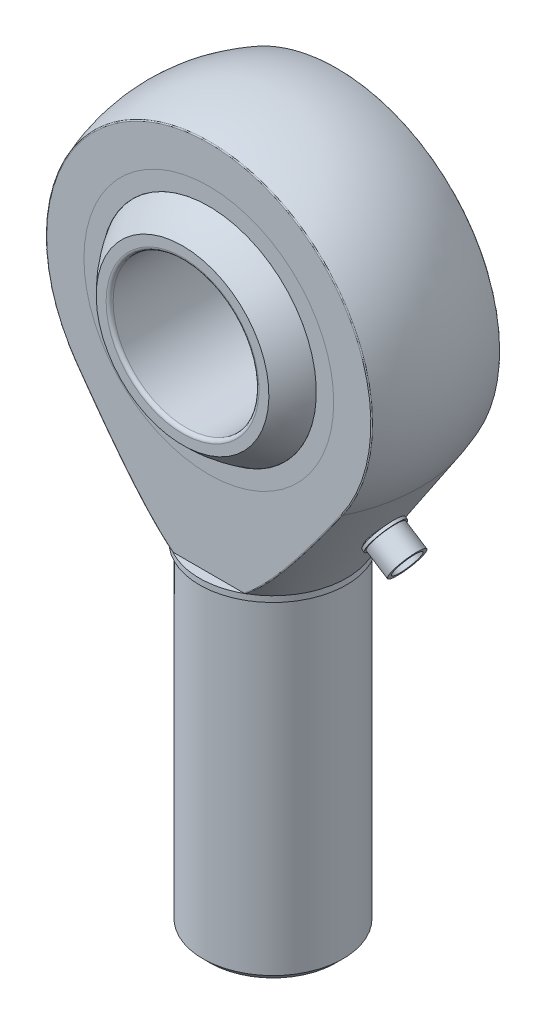
from build123d import *

# Parameters (mm, degrees)
CUT_EXTRUDE_1_DEPTH      = 132.057239403
CUT_EXTRUDE_1_DEPTH_BACK = 132.057239403
SKETCH_4_W               = 19
SKETCH_4_H               = 66
FILLET_1_R               = 0.02
FILLET_2_R               = 0.02
FILLET_3_R               = 0.2
FILLET_4_R               = 0.6


with BuildPart() as part:
    # 草图3 → 旋转2 (revolve)
    with BuildSketch(Plane.XY):
        with BuildLine():
            Line((-12, 57), (-12.6, 57))
            Line((-12.6, 57), (-12.6, 58))
            Line((-12.6, 58), (-25.280878776, 77.848307572))
            ThreePointArc((-25.280878776, 77.848307572), (-26.311126666, 108.412654633), (0, 124))
            Line((0, 124), (0, 0))
            Line((0, 0), (-10.8, 0))
            Line((-10.8, 0), (-12, 1.2))
            Line((-12, 1.2), (-12, 57))
        make_face()
    revolve(axis=Axis((0, 124, 0), (0, -1, 0)))

    # 草图4 → 切除-拉伸1 (cut, two sides: drawn at the far end of the back side and taken through both)
    with BuildSketch(Plane(origin=(0, 0, 0), x_dir=(0, 0, -1), z_dir=(1, 0, 0)).offset(-CUT_EXTRUDE_1_DEPTH_BACK)):
        with Locations((-20.5, 91)):
            Rectangle(SKETCH_4_W, SKETCH_4_H)
        with Locations((20.5, 91)):
            Rectangle(SKETCH_4_W, SKETCH_4_H)
    extrude(amount=CUT_EXTRUDE_1_DEPTH + CUT_EXTRUDE_1_DEPTH_BACK, mode=Mode.SUBTRACT)

    # 草图5 → 切除-旋转1 (revolve, cut)
    with BuildSketch(Plane(origin=(0, 0, 0), x_dir=(0, 0, -1), z_dir=(1, 0, 0))):
        with BuildLine():
            ThreePointArc((-11, 112.391435507), (-13.371231769, 110.746792558), (-15.5, 108.798476273))
            Line((-15.5, 108.798476273), (-15.5, 94))
            Line((-15.5, 94), (15.5, 94))
            Line((15.5, 94), (15.5, 108.798476273))
            ThreePointArc((15.5, 108.798476273), (13.371231769, 110.746792558), (11, 112.391435507))
            Line((11, 112.391435507), (11, 115.401294946))
            Line((11, 115.401294946), (1.11436, 117.1444))
            Line((1.11436, 117.1444), (1.11436, 115.401007027))
            ThreePointArc((1.11436, 115.401007027), (0, 115.43), (-1.11436, 115.401007027))
            Line((-1.11436, 115.401007027), (-1.11436, 117.1444))
            Line((-1.11436, 117.1444), (-11, 115.401294946))
            Line((-11, 115.401294946), (-11, 112.391435507))
        make_face()
    revolve(axis=Axis((0, 94, 25.009899453), (0, 0, -1)), mode=Mode.SUBTRACT)

    # 圆角3
    fillet_3_edges = [part.edges().sort_by_distance(p)[0] for p in [
        (-15.026137063, 67.425975947, -11),
        (15.026137063, 67.425975947, -11),
        (15.026137063, 67.425975947, 11),
        (-15.026137063, 67.425975947, 11),
        (0, 121.910571474, -11),
        (0, 121.910571474, 11),
    ]]
    fillet(fillet_3_edges, radius=FILLET_3_R)

    # 草图6 → 旋转5 (revolve)
    with BuildSketch(Plane.XY):
        Polygon((20.564035591, 70.446857766), (19.721339631, 70.985247514), (19.398305783, 70.479629938), (24.285942346, 67.356969402), (24.608976195, 67.862586977), (20.968529651, 70.188430687), (21.130046575, 70.441239475), (20.725552515, 70.699666554), align=None)
    revolve(axis=Axis((18.940439388, 67.924153786, 0), (0.8426959592098153, -0.5383897476098978, 0)))


with BuildPart() as body_2:
    # 草图5<4> → 旋转3 (revolve)
    with BuildSketch(Plane(origin=(0, 0, 0), x_dir=(0, 0, -1), z_dir=(1, 0, 0))):
        with BuildLine():
            Line((-11, 115.401294946), (-11, 112.391435507))
            ThreePointArc((-11, 112.391435507), (-6.241298722, 114.501002177), (-1.11436, 115.401007027))
            Line((-1.11436, 115.401007027), (-1.11436, 117.1444))
            Line((-1.11436, 117.1444), (-11, 115.401294946))
        make_face()
        with BuildLine():
            Line((1.11436, 117.1444), (1.11436, 115.401007027))
            ThreePointArc((1.11436, 115.401007027), (6.241298722, 114.501002177), (11, 112.391435507))
            Line((11, 112.391435507), (11, 115.401294946))
            Line((11, 115.401294946), (1.11436, 117.1444))
        make_face()
    revolve(axis=Axis((0, 94, 25.009899453), (0, 0, -1)))

    # 圆角1
    fillet_1_edges = [body_2.edges().sort_by_distance(p)[0] for p in [
        (0, 75.608564493, 11),
    ]]
    fillet(fillet_1_edges, radius=FILLET_1_R)

    # 圆角2
    fillet_2_edges = [body_2.edges().sort_by_distance(p)[0] for p in [
        (0, 72.598705054, -11),
        (0, 75.608564493, -11),
    ]]
    fillet(fillet_2_edges, radius=FILLET_2_R)


with BuildPart() as body_3:
    # 草图5<5> → 旋转4 (revolve)
    with BuildSketch(Plane(origin=(0, 0, 0), x_dir=(0, 0, -1), z_dir=(1, 0, 0))):
        with BuildLine():
            ThreePointArc((-11, 112.391435507), (-13.371231769, 110.746792558), (-15.5, 108.798476273))
            Line((-15.5, 108.798476273), (-15.5, 106.5))
            Line((-15.5, 106.5), (15.5, 106.5))
            Line((15.5, 106.5), (15.5, 108.798476273))
            ThreePointArc((15.5, 108.798476273), (13.371231769, 110.746792558), (11, 112.391435507))
            ThreePointArc((11, 112.391435507), (6.241298722, 114.501002177), (1.11436, 115.401007027))
            ThreePointArc((1.11436, 115.401007027), (0, 115.43), (-1.11436, 115.401007027))
            ThreePointArc((-1.11436, 115.401007027), (-6.241298722, 114.501002177), (-11, 112.391435507))
        make_face()
    revolve(axis=Axis((0, 94, 25.009899453), (0, 0, -1)))

    # 圆角4
    fillet_4_edges = [body_3.edges().sort_by_distance(p)[0] for p in [
        (0, 81.5, -15.5),
        (0, 81.5, 15.5),
    ]]
    fillet(fillet_4_edges, radius=FILLET_4_R)


with BuildPart() as body_4:
    # Split Bodies 1: the piece on the far side of the plane
    add(part.part)
    split(bisect_by=Plane(origin=(0, 0, 0), x_dir=(0, 0, 1), z_dir=(1, 0, 0)), keep=Keep.BOTTOM)


with BuildPart() as part_1:
    add(part.part)

    # Split Bodies 1
    split(bisect_by=Plane(origin=(0, 0, 0), x_dir=(0, 0, 1), z_dir=(1, 0, 0)), keep=Keep.TOP)


with BuildPart() as body_4_1:
    add(body_4.part)

    # Combine 1: union part
    add(part_1.part)


solid = Compound([body_2.part, body_3.part, body_4_1.part])
